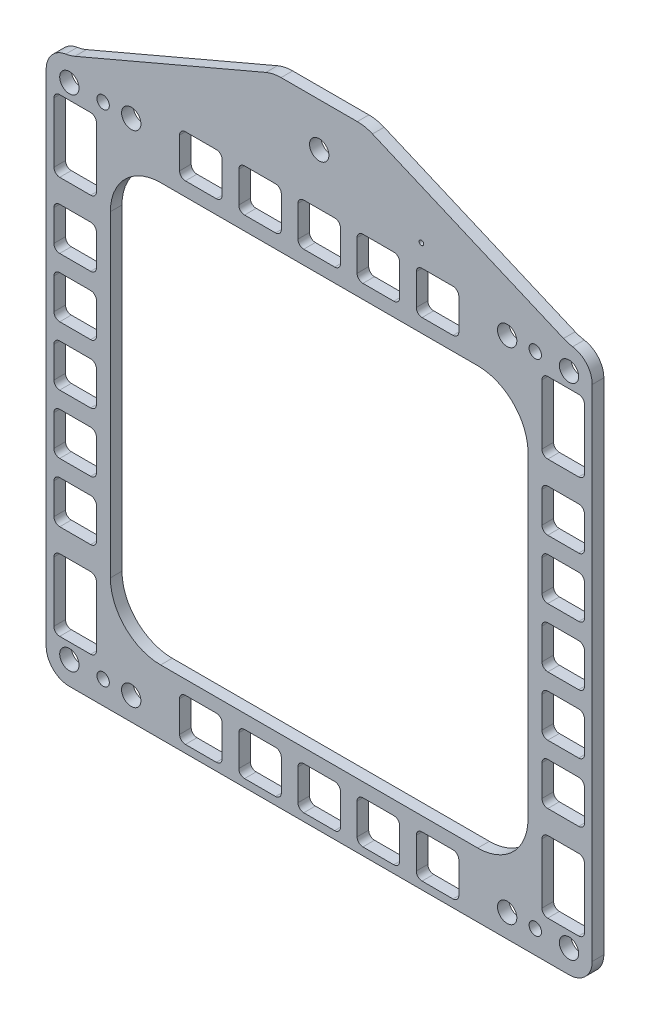
from build123d import *

# Parameters (mm, degrees)
SKETCH1_R           = 0.6
SKETCH1_R_2         = 2.5
SKETCH1_R_3         = 1.6
BOSS_EXTRUDE1_DEPTH = 3


with BuildPart() as part:
    # Sketch1 → Boss-Extrude1 (new body)
    with BuildSketch(Plane.XY):
        with BuildLine():
            Line((-70.6, -64.6), (-70.6, 64.6))
            ThreePointArc((-70.6, 64.6), (-69.163190657, 68.495804286), (-65.540902989, 70.525765905))
            ThreePointArc((-65.540902989, 70.525765905), (-64.340790015, 70.792848887), (-63.182522555, 71.205184867))
            Line((-63.182522555, 71.205184867), (-13.781138102, 92.296857547))
            ThreePointArc((-13.781138102, 92.296857547), (-11.858510235, 92.897157125), (-9.854586018, 93.1))
            Line((-9.854586018, 93.1), (9.854586018, 93.1))
            ThreePointArc((9.854586018, 93.1), (11.858510235, 92.897157125), (13.781138102, 92.296857547))
            Line((13.781138102, 92.296857547), (63.182522555, 71.205184867))
            ThreePointArc((63.182522555, 71.205184867), (64.340790015, 70.792848887), (65.540902989, 70.525765905))
            ThreePointArc((65.540902989, 70.525765905), (69.163190657, 68.495804286), (70.6, 64.6))
            Line((70.6, 64.6), (70.6, -64.6))
            ThreePointArc((70.6, -64.6), (68.842640687, -68.842640687), (64.6, -70.6))
            Line((64.6, -70.6), (-64.6, -70.6))
            ThreePointArc((-64.6, -70.6), (-68.842640687, -68.842640687), (-70.6, -64.6))
        make_face()
        with Locations((26.428961387, 74.25)):
            Circle(SKETCH1_R, mode=Mode.SUBTRACT)
        with Locations((0, 81.85)):
            Circle(SKETCH1_R_2, mode=Mode.SUBTRACT)
        with Locations((48.6, -64.6)):
            Circle(SKETCH1_R_2, mode=Mode.SUBTRACT)
        with Locations((64.6, -64.6)):
            Circle(SKETCH1_R_2, mode=Mode.SUBTRACT)
        with Locations((64.6, 64.6)):
            Circle(SKETCH1_R_2, mode=Mode.SUBTRACT)
        with Locations((-48.6, 64.6)):
            Circle(SKETCH1_R_2, mode=Mode.SUBTRACT)
        with Locations((48.6, 64.6)):
            Circle(SKETCH1_R_2, mode=Mode.SUBTRACT)
        with Locations((-48.6, -64.6)):
            Circle(SKETCH1_R_2, mode=Mode.SUBTRACT)
        with Locations((-64.6, -64.6)):
            Circle(SKETCH1_R_2, mode=Mode.SUBTRACT)
        with Locations((-64.6, 64.6)):
            Circle(SKETCH1_R_2, mode=Mode.SUBTRACT)
        with Locations((-55.87, 64.6)):
            Circle(SKETCH1_R_3, mode=Mode.SUBTRACT)
        with Locations((55.87, 64.6)):
            Circle(SKETCH1_R_3, mode=Mode.SUBTRACT)
        with Locations((55.87, -64.6)):
            Circle(SKETCH1_R_3, mode=Mode.SUBTRACT)
        with Locations((-55.87, -64.6)):
            Circle(SKETCH1_R_3, mode=Mode.SUBTRACT)
        with BuildLine():
            Line((-57.6, 43.65), (-57.6, 59.15))
            ThreePointArc((-57.6, 59.15), (-58.039339828, 60.210660172), (-59.1, 60.65))
            Line((-59.1, 60.65), (-67.1, 60.65))
            ThreePointArc((-67.1, 60.65), (-68.160660172, 60.210660172), (-68.6, 59.15))
            Line((-68.6, 59.15), (-68.6, 43.65))
            ThreePointArc((-68.6, 43.65), (-68.160660172, 42.589339828), (-67.1, 42.15))
            Line((-67.1, 42.15), (-59.1, 42.15))
            ThreePointArc((-59.1, 42.15), (-58.039339828, 42.589339828), (-57.6, 43.65))
        make_face(mode=Mode.SUBTRACT)
        with BuildLine():
            Line((-36.1, 67.1), (-36.1, 59.1))
            ThreePointArc((-36.1, 59.1), (-35.660660172, 58.039339828), (-34.6, 57.6))
            Line((-34.6, 57.6), (-26.6, 57.6))
            ThreePointArc((-26.6, 57.6), (-25.539339828, 58.039339828), (-25.1, 59.1))
            Line((-25.1, 59.1), (-25.1, 67.1))
            ThreePointArc((-25.1, 67.1), (-25.539339828, 68.160660172), (-26.6, 68.6))
            Line((-26.6, 68.6), (-34.6, 68.6))
            ThreePointArc((-34.6, 68.6), (-35.660660172, 68.160660172), (-36.1, 67.1))
        make_face(mode=Mode.SUBTRACT)
        with BuildLine():
            Line((-67.1, -60.65), (-59.1, -60.65))
            ThreePointArc((-59.1, -60.65), (-58.039339828, -60.210660172), (-57.6, -59.15))
            Line((-57.6, -59.15), (-57.6, -43.65))
            ThreePointArc((-57.6, -43.65), (-58.039339828, -42.589339828), (-59.1, -42.15))
            Line((-59.1, -42.15), (-67.1, -42.15))
            ThreePointArc((-67.1, -42.15), (-68.160660172, -42.589339828), (-68.6, -43.65))
            Line((-68.6, -43.65), (-68.6, -59.15))
            ThreePointArc((-68.6, -59.15), (-68.160660172, -60.210660172), (-67.1, -60.65))
        make_face(mode=Mode.SUBTRACT)
        with BuildLine():
            Line((67.1, -42.15), (59.1, -42.15))
            ThreePointArc((59.1, -42.15), (58.039339828, -42.589339828), (57.6, -43.65))
            Line((57.6, -43.65), (57.6, -59.15))
            ThreePointArc((57.6, -59.15), (58.039339828, -60.210660172), (59.1, -60.65))
            Line((59.1, -60.65), (67.1, -60.65))
            ThreePointArc((67.1, -60.65), (68.160660172, -60.210660172), (68.6, -59.15))
            Line((68.6, -59.15), (68.6, -43.65))
            ThreePointArc((68.6, -43.65), (68.160660172, -42.589339828), (67.1, -42.15))
        make_face(mode=Mode.SUBTRACT)
        with BuildLine():
            Line((67.1, 60.65), (59.1, 60.65))
            ThreePointArc((59.1, 60.65), (58.039339828, 60.210660172), (57.6, 59.15))
            Line((57.6, 59.15), (57.6, 43.65))
            ThreePointArc((57.6, 43.65), (58.039339828, 42.589339828), (59.1, 42.15))
            Line((59.1, 42.15), (67.1, 42.15))
            ThreePointArc((67.1, 42.15), (68.160660172, 42.589339828), (68.6, 43.65))
            Line((68.6, 43.65), (68.6, 59.15))
            ThreePointArc((68.6, 59.15), (68.160660172, 60.210660172), (67.1, 60.65))
        make_face(mode=Mode.SUBTRACT)
        with BuildLine():
            Line((68.6, 26.6), (68.6, 34.6))
            ThreePointArc((68.6, 34.6), (68.160660172, 35.660660172), (67.1, 36.1))
            Line((67.1, 36.1), (59.1, 36.1))
            ThreePointArc((59.1, 36.1), (58.039339828, 35.660660172), (57.6, 34.6))
            Line((57.6, 34.6), (57.6, 26.6))
            ThreePointArc((57.6, 26.6), (58.039339828, 25.539339828), (59.1, 25.1))
            Line((59.1, 25.1), (67.1, 25.1))
            ThreePointArc((67.1, 25.1), (68.160660172, 25.539339828), (68.6, 26.6))
        make_face(mode=Mode.SUBTRACT)
        with BuildLine():
            Line((68.6, 11.3), (68.6, 19.3))
            ThreePointArc((68.6, 19.3), (68.160660172, 20.360660172), (67.1, 20.8))
            Line((67.1, 20.8), (59.1, 20.8))
            ThreePointArc((59.1, 20.8), (58.039339828, 20.360660172), (57.6, 19.3))
            Line((57.6, 19.3), (57.6, 11.3))
            ThreePointArc((57.6, 11.3), (58.039339828, 10.239339828), (59.1, 9.8))
            Line((59.1, 9.8), (67.1, 9.8))
            ThreePointArc((67.1, 9.8), (68.160660172, 10.239339828), (68.6, 11.3))
        make_face(mode=Mode.SUBTRACT)
        with BuildLine():
            Line((68.6, -4), (68.6, 4))
            ThreePointArc((68.6, 4), (68.160660172, 5.060660172), (67.1, 5.5))
            Line((67.1, 5.5), (59.1, 5.5))
            ThreePointArc((59.1, 5.5), (58.039339828, 5.060660172), (57.6, 4))
            Line((57.6, 4), (57.6, -4))
            ThreePointArc((57.6, -4), (58.039339828, -5.060660172), (59.1, -5.5))
            Line((59.1, -5.5), (67.1, -5.5))
            ThreePointArc((67.1, -5.5), (68.160660172, -5.060660172), (68.6, -4))
        make_face(mode=Mode.SUBTRACT)
        with BuildLine():
            Line((68.6, -19.3), (68.6, -11.3))
            ThreePointArc((68.6, -11.3), (68.160660172, -10.239339828), (67.1, -9.8))
            Line((67.1, -9.8), (59.1, -9.8))
            ThreePointArc((59.1, -9.8), (58.039339828, -10.239339828), (57.6, -11.3))
            Line((57.6, -11.3), (57.6, -19.3))
            ThreePointArc((57.6, -19.3), (58.039339828, -20.360660172), (59.1, -20.8))
            Line((59.1, -20.8), (67.1, -20.8))
            ThreePointArc((67.1, -20.8), (68.160660172, -20.360660172), (68.6, -19.3))
        make_face(mode=Mode.SUBTRACT)
        with BuildLine():
            Line((68.6, -34.6), (68.6, -26.6))
            ThreePointArc((68.6, -26.6), (68.160660172, -25.539339828), (67.1, -25.1))
            Line((67.1, -25.1), (59.1, -25.1))
            ThreePointArc((59.1, -25.1), (58.039339828, -25.539339828), (57.6, -26.6))
            Line((57.6, -26.6), (57.6, -34.6))
            ThreePointArc((57.6, -34.6), (58.039339828, -35.660660172), (59.1, -36.1))
            Line((59.1, -36.1), (67.1, -36.1))
            ThreePointArc((67.1, -36.1), (68.160660172, -35.660660172), (68.6, -34.6))
        make_face(mode=Mode.SUBTRACT)
        with BuildLine():
            Line((26.6, -68.6), (34.6, -68.6))
            ThreePointArc((34.6, -68.6), (35.660660172, -68.160660172), (36.1, -67.1))
            Line((36.1, -67.1), (36.1, -59.1))
            ThreePointArc((36.1, -59.1), (35.660660172, -58.039339828), (34.6, -57.6))
            Line((34.6, -57.6), (26.6, -57.6))
            ThreePointArc((26.6, -57.6), (25.539339828, -58.039339828), (25.1, -59.1))
            Line((25.1, -59.1), (25.1, -67.1))
            ThreePointArc((25.1, -67.1), (25.539339828, -68.160660172), (26.6, -68.6))
        make_face(mode=Mode.SUBTRACT)
        with BuildLine():
            Line((11.3, -68.6), (19.3, -68.6))
            ThreePointArc((19.3, -68.6), (20.360660172, -68.160660172), (20.8, -67.1))
            Line((20.8, -67.1), (20.8, -59.1))
            ThreePointArc((20.8, -59.1), (20.360660172, -58.039339828), (19.3, -57.6))
            Line((19.3, -57.6), (11.3, -57.6))
            ThreePointArc((11.3, -57.6), (10.239339828, -58.039339828), (9.8, -59.1))
            Line((9.8, -59.1), (9.8, -67.1))
            ThreePointArc((9.8, -67.1), (10.239339828, -68.160660172), (11.3, -68.6))
        make_face(mode=Mode.SUBTRACT)
        with BuildLine():
            Line((-4, -68.6), (4, -68.6))
            ThreePointArc((4, -68.6), (5.060660172, -68.160660172), (5.5, -67.1))
            Line((5.5, -67.1), (5.5, -59.1))
            ThreePointArc((5.5, -59.1), (5.060660172, -58.039339828), (4, -57.6))
            Line((4, -57.6), (-4, -57.6))
            ThreePointArc((-4, -57.6), (-5.060660172, -58.039339828), (-5.5, -59.1))
            Line((-5.5, -59.1), (-5.5, -67.1))
            ThreePointArc((-5.5, -67.1), (-5.060660172, -68.160660172), (-4, -68.6))
        make_face(mode=Mode.SUBTRACT)
        with BuildLine():
            Line((-19.3, -68.6), (-11.3, -68.6))
            ThreePointArc((-11.3, -68.6), (-10.239339828, -68.160660172), (-9.8, -67.1))
            Line((-9.8, -67.1), (-9.8, -59.1))
            ThreePointArc((-9.8, -59.1), (-10.239339828, -58.039339828), (-11.3, -57.6))
            Line((-11.3, -57.6), (-19.3, -57.6))
            ThreePointArc((-19.3, -57.6), (-20.360660172, -58.039339828), (-20.8, -59.1))
            Line((-20.8, -59.1), (-20.8, -67.1))
            ThreePointArc((-20.8, -67.1), (-20.360660172, -68.160660172), (-19.3, -68.6))
        make_face(mode=Mode.SUBTRACT)
        with BuildLine():
            Line((-34.6, -68.6), (-26.6, -68.6))
            ThreePointArc((-26.6, -68.6), (-25.539339828, -68.160660172), (-25.1, -67.1))
            Line((-25.1, -67.1), (-25.1, -59.1))
            ThreePointArc((-25.1, -59.1), (-25.539339828, -58.039339828), (-26.6, -57.6))
            Line((-26.6, -57.6), (-34.6, -57.6))
            ThreePointArc((-34.6, -57.6), (-35.660660172, -58.039339828), (-36.1, -59.1))
            Line((-36.1, -59.1), (-36.1, -67.1))
            ThreePointArc((-36.1, -67.1), (-35.660660172, -68.160660172), (-34.6, -68.6))
        make_face(mode=Mode.SUBTRACT)
        with BuildLine():
            Line((-41, 54), (41, 54))
            ThreePointArc((41, 54), (50.192388155, 50.192388155), (54, 41))
            Line((54, 41), (54, -41))
            ThreePointArc((54, -41), (50.192388155, -50.192388155), (41, -54))
            Line((41, -54), (-41, -54))
            ThreePointArc((-41, -54), (-50.192388155, -50.192388155), (-54, -41))
            Line((-54, -41), (-54, 41))
            ThreePointArc((-54, 41), (-50.192388155, 50.192388155), (-41, 54))
        make_face(mode=Mode.SUBTRACT)
        with BuildLine():
            Line((-67.1, 25.1), (-59.1, 25.1))
            ThreePointArc((-59.1, 25.1), (-58.039339828, 25.539339828), (-57.6, 26.6))
            Line((-57.6, 26.6), (-57.6, 34.6))
            ThreePointArc((-57.6, 34.6), (-58.039339828, 35.660660172), (-59.1, 36.1))
            Line((-59.1, 36.1), (-67.1, 36.1))
            ThreePointArc((-67.1, 36.1), (-68.160660172, 35.660660172), (-68.6, 34.6))
            Line((-68.6, 34.6), (-68.6, 26.6))
            ThreePointArc((-68.6, 26.6), (-68.160660172, 25.539339828), (-67.1, 25.1))
        make_face(mode=Mode.SUBTRACT)
        with BuildLine():
            Line((-20.8, 67.1), (-20.8, 59.1))
            ThreePointArc((-20.8, 59.1), (-20.360660172, 58.039339828), (-19.3, 57.6))
            Line((-19.3, 57.6), (-11.3, 57.6))
            ThreePointArc((-11.3, 57.6), (-10.239339828, 58.039339828), (-9.8, 59.1))
            Line((-9.8, 59.1), (-9.8, 67.1))
            ThreePointArc((-9.8, 67.1), (-10.239339828, 68.160660172), (-11.3, 68.6))
            Line((-11.3, 68.6), (-19.3, 68.6))
            ThreePointArc((-19.3, 68.6), (-20.360660172, 68.160660172), (-20.8, 67.1))
        make_face(mode=Mode.SUBTRACT)
        with BuildLine():
            Line((-5.5, 67.1), (-5.5, 59.1))
            ThreePointArc((-5.5, 59.1), (-5.060660172, 58.039339828), (-4, 57.6))
            Line((-4, 57.6), (4, 57.6))
            ThreePointArc((4, 57.6), (5.060660172, 58.039339828), (5.5, 59.1))
            Line((5.5, 59.1), (5.5, 67.1))
            ThreePointArc((5.5, 67.1), (5.060660172, 68.160660172), (4, 68.6))
            Line((4, 68.6), (-4, 68.6))
            ThreePointArc((-4, 68.6), (-5.060660172, 68.160660172), (-5.5, 67.1))
        make_face(mode=Mode.SUBTRACT)
        with BuildLine():
            Line((-67.1, 9.8), (-59.1, 9.8))
            ThreePointArc((-59.1, 9.8), (-58.039339828, 10.239339828), (-57.6, 11.3))
            Line((-57.6, 11.3), (-57.6, 19.3))
            ThreePointArc((-57.6, 19.3), (-58.039339828, 20.360660172), (-59.1, 20.8))
            Line((-59.1, 20.8), (-67.1, 20.8))
            ThreePointArc((-67.1, 20.8), (-68.160660172, 20.360660172), (-68.6, 19.3))
            Line((-68.6, 19.3), (-68.6, 11.3))
            ThreePointArc((-68.6, 11.3), (-68.160660172, 10.239339828), (-67.1, 9.8))
        make_face(mode=Mode.SUBTRACT)
        with BuildLine():
            Line((-67.1, -5.5), (-59.1, -5.5))
            ThreePointArc((-59.1, -5.5), (-58.039339828, -5.060660172), (-57.6, -4))
            Line((-57.6, -4), (-57.6, 4))
            ThreePointArc((-57.6, 4), (-58.039339828, 5.060660172), (-59.1, 5.5))
            Line((-59.1, 5.5), (-67.1, 5.5))
            ThreePointArc((-67.1, 5.5), (-68.160660172, 5.060660172), (-68.6, 4))
            Line((-68.6, 4), (-68.6, -4))
            ThreePointArc((-68.6, -4), (-68.160660172, -5.060660172), (-67.1, -5.5))
        make_face(mode=Mode.SUBTRACT)
        with BuildLine():
            Line((-67.1, -20.8), (-59.1, -20.8))
            ThreePointArc((-59.1, -20.8), (-58.039339828, -20.360660172), (-57.6, -19.3))
            Line((-57.6, -19.3), (-57.6, -11.3))
            ThreePointArc((-57.6, -11.3), (-58.039339828, -10.239339828), (-59.1, -9.8))
            Line((-59.1, -9.8), (-67.1, -9.8))
            ThreePointArc((-67.1, -9.8), (-68.160660172, -10.239339828), (-68.6, -11.3))
            Line((-68.6, -11.3), (-68.6, -19.3))
            ThreePointArc((-68.6, -19.3), (-68.160660172, -20.360660172), (-67.1, -20.8))
        make_face(mode=Mode.SUBTRACT)
        with BuildLine():
            Line((-67.1, -36.1), (-59.1, -36.1))
            ThreePointArc((-59.1, -36.1), (-58.039339828, -35.660660172), (-57.6, -34.6))
            Line((-57.6, -34.6), (-57.6, -26.6))
            ThreePointArc((-57.6, -26.6), (-58.039339828, -25.539339828), (-59.1, -25.1))
            Line((-59.1, -25.1), (-67.1, -25.1))
            ThreePointArc((-67.1, -25.1), (-68.160660172, -25.539339828), (-68.6, -26.6))
            Line((-68.6, -26.6), (-68.6, -34.6))
            ThreePointArc((-68.6, -34.6), (-68.160660172, -35.660660172), (-67.1, -36.1))
        make_face(mode=Mode.SUBTRACT)
        with BuildLine():
            Line((25.1, 67.1), (25.1, 59.1))
            ThreePointArc((25.1, 59.1), (25.539339828, 58.039339828), (26.6, 57.6))
            Line((26.6, 57.6), (34.6, 57.6))
            ThreePointArc((34.6, 57.6), (35.660660172, 58.039339828), (36.1, 59.1))
            Line((36.1, 59.1), (36.1, 67.1))
            ThreePointArc((36.1, 67.1), (35.660660172, 68.160660172), (34.6, 68.6))
            Line((34.6, 68.6), (26.6, 68.6))
            ThreePointArc((26.6, 68.6), (25.539339828, 68.160660172), (25.1, 67.1))
        make_face(mode=Mode.SUBTRACT)
        with BuildLine():
            Line((9.8, 67.1), (9.8, 59.1))
            ThreePointArc((9.8, 59.1), (10.239339828, 58.039339828), (11.3, 57.6))
            Line((11.3, 57.6), (19.3, 57.6))
            ThreePointArc((19.3, 57.6), (20.360660172, 58.039339828), (20.8, 59.1))
            Line((20.8, 59.1), (20.8, 67.1))
            ThreePointArc((20.8, 67.1), (20.360660172, 68.160660172), (19.3, 68.6))
            Line((19.3, 68.6), (11.3, 68.6))
            ThreePointArc((11.3, 68.6), (10.239339828, 68.160660172), (9.8, 67.1))
        make_face(mode=Mode.SUBTRACT)
    extrude(amount=BOSS_EXTRUDE1_DEPTH)


solid = part.part
